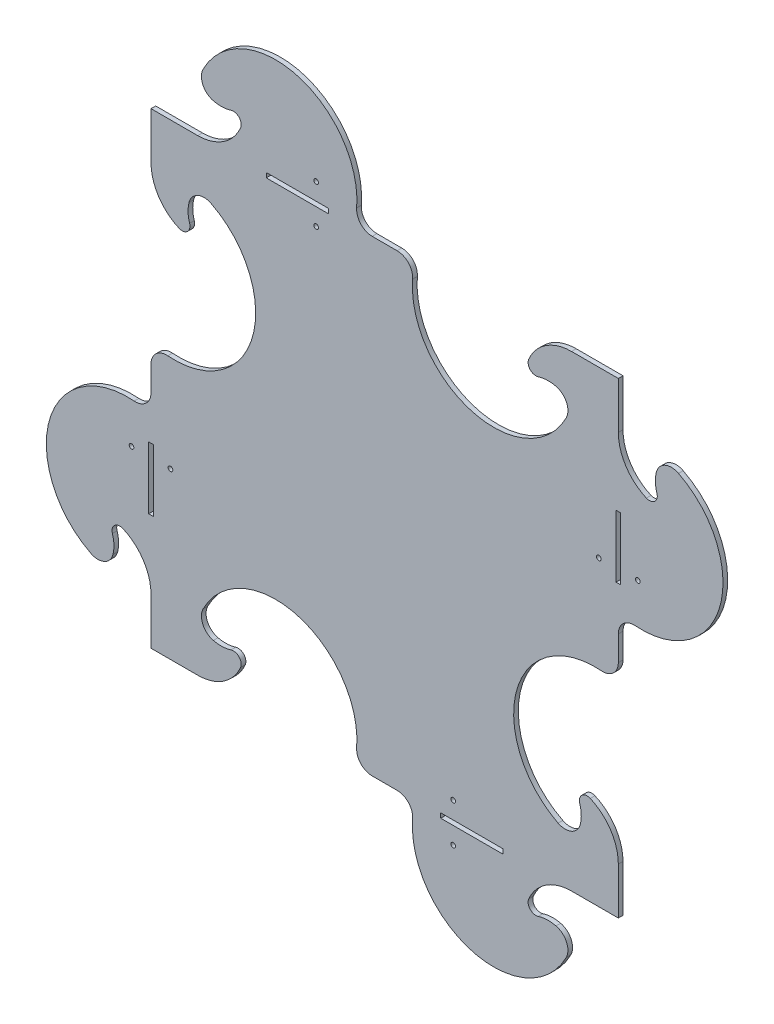
from build123d import *

# Parameters (mm, degrees)
RESSALTO_EXTRUS_O1_DEPTH = 3
ESBO_O2_W                = 40
ESBO_O2_H                = 3
ESBO_O2_W_2              = 3
ESBO_O2_H_2              = 40
CORTE_EXTRUS_O1_DEPTH    = 436.556992799
ESBO_O3_R                = 1.5
CORTE_EXTRUS_O2_DEPTH    = 436.556992799


with BuildPart() as part:
    # Esboço1 → Ressalto-extrusão1 (new body)
    with BuildSketch(Plane.XY):
        with BuildLine():
            Line((-241.20368795, -59.651351358), (-241.20368795, -29.651351358))
            ThreePointArc((-241.20368795, -29.651351358), (-246.107895674, -13.213553147), (-259.217101951, -2.150046733))
            ThreePointArc((-259.217101951, -2.150046733), (-264.561513741, -3.018769002), (-265.981323334, -8.243858139))
            ThreePointArc((-265.981323334, -8.243858139), (-265.003447457, -13.909864328), (-265.583076332, -19.630344878))
            ThreePointArc((-265.583076332, -19.630344878), (-271.11591561, -26.364097317), (-279.829636843, -26.200406546))
            ThreePointArc((-279.829636843, -26.200406546), (-306.442768457, 34.527322411), (-252.007526665, 72.381256019))
            ThreePointArc((-252.007526665, 72.381256019), (-244.422773084, 74.999120757), (-241.20368795, 82.348895826))
            Line((-241.20368795, 82.348895826), (-241.20368795, 98.348401458))
            ThreePointArc((-241.20368795, 98.348401458), (-237.984602816, 105.698176528), (-230.399849235, 108.316041265))
            ThreePointArc((-230.399849235, 108.316041265), (-175.964607443, 146.169974874), (-202.577739058, 206.897703831))
            ThreePointArc((-202.577739058, 206.897703831), (-211.29146029, 207.061394601), (-216.824299569, 200.327642163))
            ThreePointArc((-216.824299569, 200.327642163), (-217.403928444, 194.607161612), (-216.426052566, 188.941155423))
            ThreePointArc((-216.426052566, 188.941155423), (-217.845862159, 183.716066286), (-223.190273949, 182.847344017))
            ThreePointArc((-223.190273949, 182.847344017), (-236.299480227, 193.910850432), (-241.20368795, 210.348648642))
            Line((-241.20368795, 210.348648642), (-241.20368795, 240.348648642))
            Line((-241.20368795, 240.348648642), (-211.20368795, 240.348648642))
            ThreePointArc((-211.20368795, 240.348648642), (-194.76588974, 245.252856366), (-183.702383325, 258.362062643))
            ThreePointArc((-183.702383325, 258.362062643), (-184.571105594, 263.706474433), (-189.796194731, 265.126284027))
            ThreePointArc((-189.796194731, 265.126284027), (-195.46220092, 264.148408149), (-201.182681471, 264.728037024))
            ThreePointArc((-201.182681471, 264.728037024), (-207.916433909, 270.260876302), (-207.752743138, 278.974597535))
            ThreePointArc((-207.752743138, 278.974597535), (-147.025014182, 305.587729149), (-109.171080573, 251.152487357))
            ThreePointArc((-109.171080573, 251.152487357), (-106.553215836, 243.567733776), (-99.203440766, 240.348648642))
            Line((-99.203440766, 240.348648642), (-83.203935134, 240.348648642))
            ThreePointArc((-83.203935134, 240.348648642), (-75.854160064, 237.129563509), (-73.236295327, 229.544809927))
            ThreePointArc((-73.236295327, 229.544809927), (-35.382361719, 175.109568135), (25.345367238, 201.72269975))
            ThreePointArc((25.345367238, 201.72269975), (25.509058009, 210.436420982), (18.775305571, 215.969260261))
            ThreePointArc((18.775305571, 215.969260261), (13.05482502, 216.548889136), (7.388818831, 215.571013258))
            ThreePointArc((7.388818831, 215.571013258), (2.163729694, 216.990822851), (1.295007425, 222.335234642))
            ThreePointArc((1.295007425, 222.335234642), (12.358513839, 235.444440919), (28.79631205, 240.348648642))
            Line((28.79631205, 240.348648642), (58.79631205, 240.348648642))
            Line((58.79631205, 240.348648642), (58.79631205, 210.348648642))
            ThreePointArc((58.79631205, 210.348648642), (63.700519773, 193.910850432), (76.809726051, 182.847344017))
            ThreePointArc((76.809726051, 182.847344017), (82.154137841, 183.716066286), (83.573947435, 188.941155423))
            ThreePointArc((83.573947435, 188.941155423), (82.596071557, 194.607161612), (83.175700432, 200.327642163))
            ThreePointArc((83.175700432, 200.327642163), (88.70853971, 207.061394601), (97.422260943, 206.89770383))
            ThreePointArc((97.422260943, 206.89770383), (124.035392557, 146.169974874), (69.600150765, 108.316041265))
            ThreePointArc((69.600150765, 108.316041265), (62.015397184, 105.698176528), (58.79631205, 98.348401458))
            Line((58.79631205, 98.348401458), (58.79631205, 82.348895826))
            ThreePointArc((58.79631205, 82.348895826), (55.577226916, 74.999120757), (47.992473335, 72.381256019))
            ThreePointArc((47.992473335, 72.381256019), (-6.442768457, 34.527322411), (20.170363157, -26.200406546))
            ThreePointArc((20.170363157, -26.200406546), (28.88408439, -26.364097317), (34.416923668, -19.630344878))
            ThreePointArc((34.416923668, -19.630344878), (34.996552543, -13.909864328), (34.018676666, -8.243858139))
            ThreePointArc((34.018676666, -8.243858139), (35.438486259, -3.018769002), (40.782898049, -2.150046733))
            ThreePointArc((40.782898049, -2.150046733), (53.892104326, -13.213553147), (58.79631205, -29.651351358))
            Line((58.79631205, -29.651351358), (58.79631205, -59.651351358))
            Line((58.79631205, -59.651351358), (28.79631205, -59.651351358))
            ThreePointArc((28.79631205, -59.651351358), (12.358513839, -64.555559081), (1.295007425, -77.664765358))
            ThreePointArc((1.295007425, -77.664765358), (2.163729694, -83.009177149), (7.388818831, -84.428986742))
            ThreePointArc((7.388818831, -84.428986742), (13.05482502, -83.451110864), (18.775305571, -84.030739739))
            ThreePointArc((18.775305571, -84.030739739), (25.509058009, -89.563579018), (25.345367238, -98.27730025))
            ThreePointArc((25.345367238, -98.27730025), (-35.382361719, -124.890431865), (-73.236295327, -70.455190073))
            ThreePointArc((-73.236295327, -70.455190073), (-75.854160064, -62.870436491), (-83.203935134, -59.651351358))
            Line((-83.203935134, -59.651351358), (-99.203440766, -59.651351358))
            ThreePointArc((-99.203440766, -59.651351358), (-106.553215836, -56.432266224), (-109.171080573, -48.847512643))
            ThreePointArc((-109.171080573, -48.847512643), (-147.025014182, 5.587729149), (-207.752743138, -21.025402465))
            ThreePointArc((-207.752743138, -21.025402465), (-207.916433909, -29.739123698), (-201.182681471, -35.271962976))
            ThreePointArc((-201.182681471, -35.271962976), (-195.46220092, -35.851591851), (-189.796194731, -34.873715973))
            ThreePointArc((-189.796194731, -34.873715973), (-184.571105594, -36.293525567), (-183.702383325, -41.637937357))
            ThreePointArc((-183.702383325, -41.637937357), (-194.76588974, -54.747143634), (-211.20368795, -59.651351358))
            Line((-211.20368795, -59.651351358), (-241.20368795, -59.651351358))
        make_face()
    extrude(amount=RESSALTO_EXTRUS_O1_DEPTH)

    # Esboço2 → Corte-extrusão1 (cut, through all)
    with BuildSketch(Plane(origin=(0, 0, 0), x_dir=(-1, 0, 0), z_dir=(0, 0, -1))):
        with Locations((147.203935134, 240.348648642)):
            Rectangle(ESBO_O2_W, ESBO_O2_H)
        with Locations((-58.79631205, 146.348895826)):
            Rectangle(ESBO_O2_W_2, ESBO_O2_H_2)
        with Locations((35.20368795, -59.651351358)):
            Rectangle(ESBO_O2_W, ESBO_O2_H)
        with Locations((241.20368795, 34.348401458)):
            Rectangle(ESBO_O2_W_2, ESBO_O2_H_2)
    extrude(amount=-CORTE_EXTRUS_O1_DEPTH, mode=Mode.SUBTRACT)

    # Esboço3 → Corte-extrusão2 (cut, through all)
    with BuildSketch(Plane.XY.offset(3)):
        with Locations((-228.70368795, 46.348648642)):
            Circle(ESBO_O3_R)
        with Locations((-47.20368795, -47.151351358)):
            Circle(ESBO_O3_R)
        with Locations((46.29631205, 134.348648642)):
            Circle(ESBO_O3_R)
        with Locations((-135.20368795, 227.848648642)):
            Circle(ESBO_O3_R)
        with Locations((-47.20368795, -72.151351358)):
            Circle(ESBO_O3_R)
        with Locations((-253.70368795, 46.348648642)):
            Circle(ESBO_O3_R)
        with Locations((-135.20368795, 252.848648642)):
            Circle(ESBO_O3_R)
        with Locations((71.29631205, 134.348648642)):
            Circle(ESBO_O3_R)
    extrude(amount=-CORTE_EXTRUS_O2_DEPTH, mode=Mode.SUBTRACT)


solid = part.part
